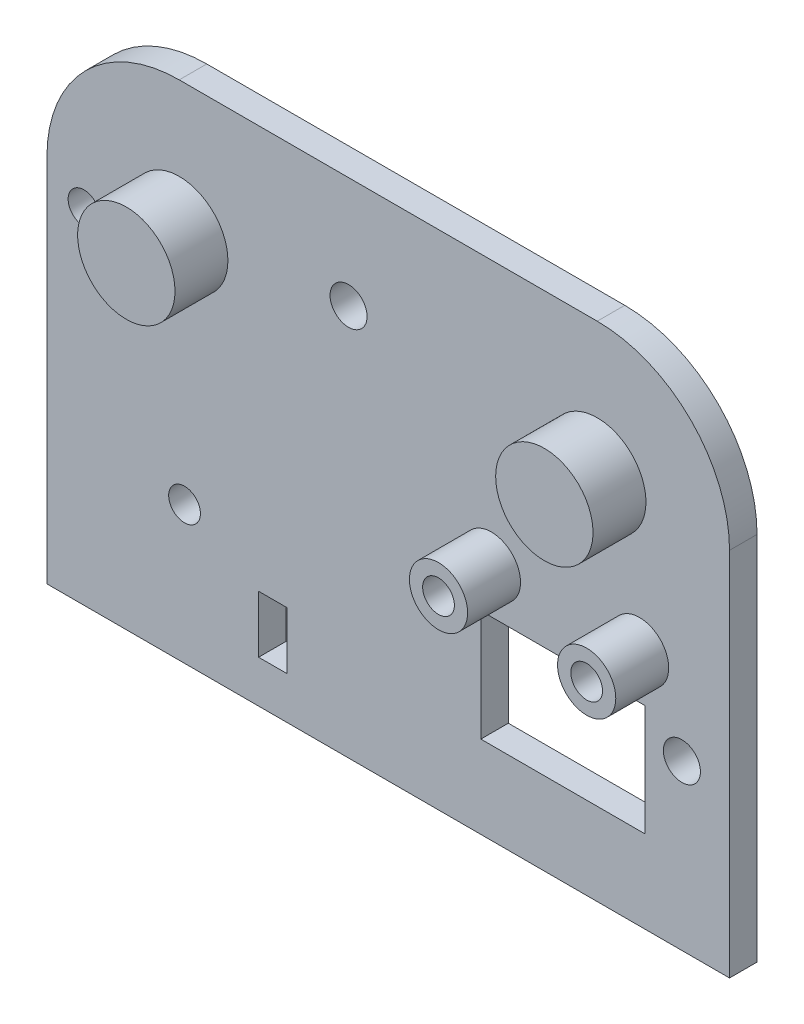
from build123d import *

# Parameters (mm, degrees)
SKETCH_1_W          = 64.5
SKETCH_1_H          = 47.5
EXTRUDE_1_DEPTH     = 2.6
FILLET_1_R          = 12.5
SKETCH_2_R          = 1.5
SKETCH_2_R_2        = 1.75
SKETCH_2_W          = 2.7
SKETCH_2_H          = 5.4
SKETCH_2_W_2        = 15.5
SKETCH_2_H_2        = 10.5
CUT_EXTRUDE_1_DEPTH = 2.6
SKETCH_3_R          = 4.6
SKETCH_3_R_2        = 2.75
EXTRUDE_2_DEPTH     = 5
CUT_EXTRUDE_START   = -26
SKETCH_4_R          = 1.5
CUT_EXTRUDE_2_DEPTH = 26


with BuildPart() as part:
    # 草图1 → 凸台-拉伸1 (new body)
    with BuildSketch(Plane.XY):
        Rectangle(SKETCH_1_W, SKETCH_1_H)
    extrude(amount=EXTRUDE_1_DEPTH)

    # 圆角1
    fillet_1_edges = [part.edges().sort_by_distance(p)[0] for p in [
        (-32.25, 23.75, 1.3),
        (32.25, 23.75, 1.3),
    ]]
    fillet(fillet_1_edges, radius=FILLET_1_R)

    # 草图2 → 切除-拉伸1 (cut)
    with BuildSketch(Plane.XY.offset(2.6)):
        with Locations((-19.25, -10.75)):
            Circle(SKETCH_2_R)
        with Locations((-28.75, 8.75)):
            Circle(SKETCH_2_R)
        with Locations((27.75, -8.25)):
            Circle(SKETCH_2_R_2)
        with Locations((23.75, -1.25)):
            Circle(SKETCH_2_R)
        with Locations((9.75, -1.25)):
            Circle(SKETCH_2_R)
        with Locations((-3.75, 13.25)):
            Circle(SKETCH_2_R_2)
        with Locations((-10.9, -17.05)):
            Rectangle(SKETCH_2_W, SKETCH_2_H)
        with Locations((16.5, -10.7)):
            Rectangle(SKETCH_2_W_2, SKETCH_2_H_2)
    extrude(amount=-CUT_EXTRUDE_1_DEPTH, mode=Mode.SUBTRACT)

    # 草图3 → 凸台-拉伸2 (add)
    with BuildSketch(Plane.XY.offset(2.6)):
        with Locations((-19.75, 11.25)):
            Circle(SKETCH_3_R)
        with Locations(Location((19.75, 11.25, 0), (0, 0, 180))):
            Circle(SKETCH_3_R)
        with Locations((9.75, -1.25)):
            Circle(SKETCH_3_R_2)
        with Locations((23.75, -1.25)):
            Circle(SKETCH_3_R_2)
    extrude(amount=EXTRUDE_2_DEPTH)

    # 草图4 → 切除-拉伸2 (cut)
    with BuildSketch(Plane(origin=(0, 0, 0), x_dir=(-1, 0, 0), z_dir=(0, 0, -1)).offset(CUT_EXTRUDE_START)):
        with Locations(Location((-23.75, -1.25, 0), (0, 0, 180))):
            Circle(SKETCH_4_R)
        with Locations(Location((-9.75, -1.25, 0), (0, 0, 180))):
            Circle(SKETCH_4_R)
    extrude(amount=CUT_EXTRUDE_2_DEPTH, mode=Mode.SUBTRACT)


solid = part.part
